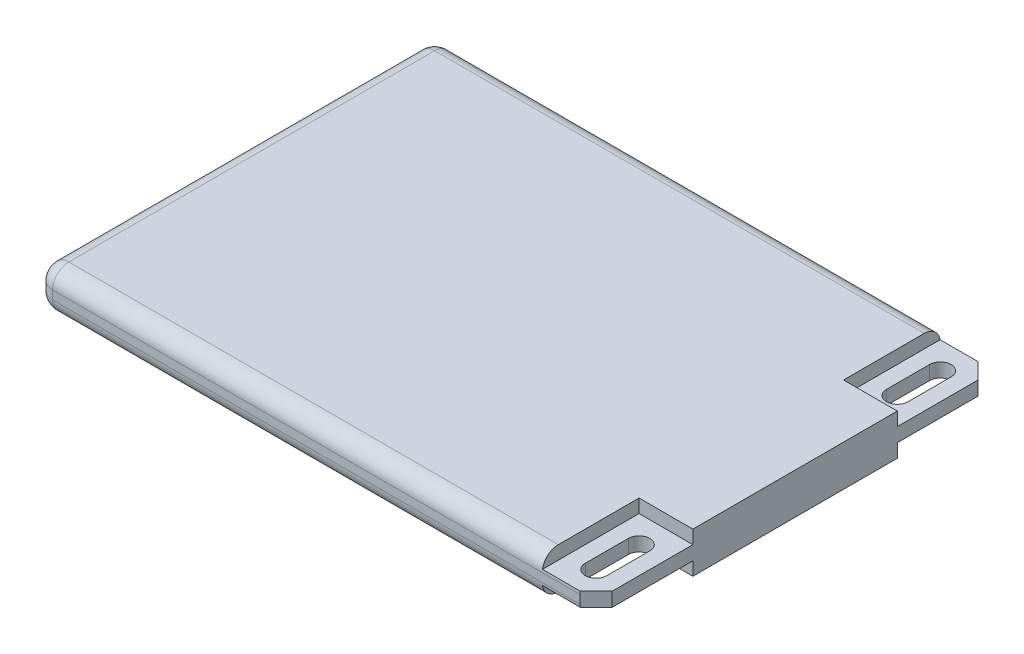
from build123d import *

# Parameters (mm, degrees)
SKETCH1_W           = 52
SKETCH1_H           = 37
BOSS_EXTRUDE1_DEPTH = 1.9
SKETCH2_W           = 5
SKETCH2_H           = 9
CUT_EXTRUDE1_DEPTH  = 1.25
CUT_EXTRUDE2_DEPTH  = 33.011755653
CHAMFER1_SIZE       = 1.5
FILLET2_R           = 1.5


with BuildPart() as part:
    # Sketch1 → Boss-Extrude1 (new, symmetric)
    with BuildSketch(Plane(origin=(0, 0, 0), x_dir=(1, 0, 0), z_dir=(0, 1, 0))):
        Rectangle(SKETCH1_W, SKETCH1_H)
    extrude(amount=BOSS_EXTRUDE1_DEPTH, both=True)

    # Sketch2 → Cut-Extrude1 (cut)
    with BuildSketch(Plane(origin=(0, 1.9, 0), x_dir=(1, 0, 0), z_dir=(0, 1, 0))):
        with Locations((23.5, 14)):
            Rectangle(SKETCH2_W, SKETCH2_H)
        with Locations((23.5, -14)):
            Rectangle(SKETCH2_W, SKETCH2_H)
    cut_extrude1 = extrude(amount=-CUT_EXTRUDE1_DEPTH, mode=Mode.SUBTRACT)

    # Mirror1: Cut-Extrude1 across plane
    add(cut_extrude1.mirror(Plane.ZX), mode=Mode.SUBTRACT)

    # Sketch3 → Cut-Extrude2 (cut, through all)
    with BuildSketch(Plane(origin=(0, 0.65, 0), x_dir=(1, 0, 0), z_dir=(0, 1, 0))):
        with BuildLine():
            Line((22.5, 12), (22.5, 16))
            ThreePointArc((22.5, 16), (23.5, 17), (24.5, 16))
            Line((24.5, 16), (24.5, 12))
            ThreePointArc((24.5, 12), (23.5, 11), (22.5, 12))
        make_face()
        with BuildLine():
            Line((22.5, -12), (22.5, -16))
            ThreePointArc((22.5, -16), (23.5, -17), (24.5, -16))
            Line((24.5, -16), (24.5, -12))
            ThreePointArc((24.5, -12), (23.5, -11), (22.5, -12))
        make_face()
    extrude(amount=-CUT_EXTRUDE2_DEPTH, mode=Mode.SUBTRACT)

    # Chamfer1
    chamfer1_edges = [part.edges().sort_by_distance(p)[0] for p in [
        (26, 0, -18.5),
        (26, 0, 18.5),
    ]]
    chamfer(chamfer1_edges, length=CHAMFER1_SIZE)

    # Fillet2
    fillet2_edges = [part.edges().sort_by_distance(p)[0] for p in [
        (-2.5, -1.9, -18.5),
        (-26, 0, -18.5),
        (-26, 0, 18.5),
        (-26, -1.9, 0),
        (-2.5, -1.9, 18.5),
        (-2.5, 1.9, 18.5),
        (-26, 1.9, 0),
        (-2.5, 1.9, -18.5),
    ]]
    fillet(fillet2_edges, radius=FILLET2_R)


solid = part.part
